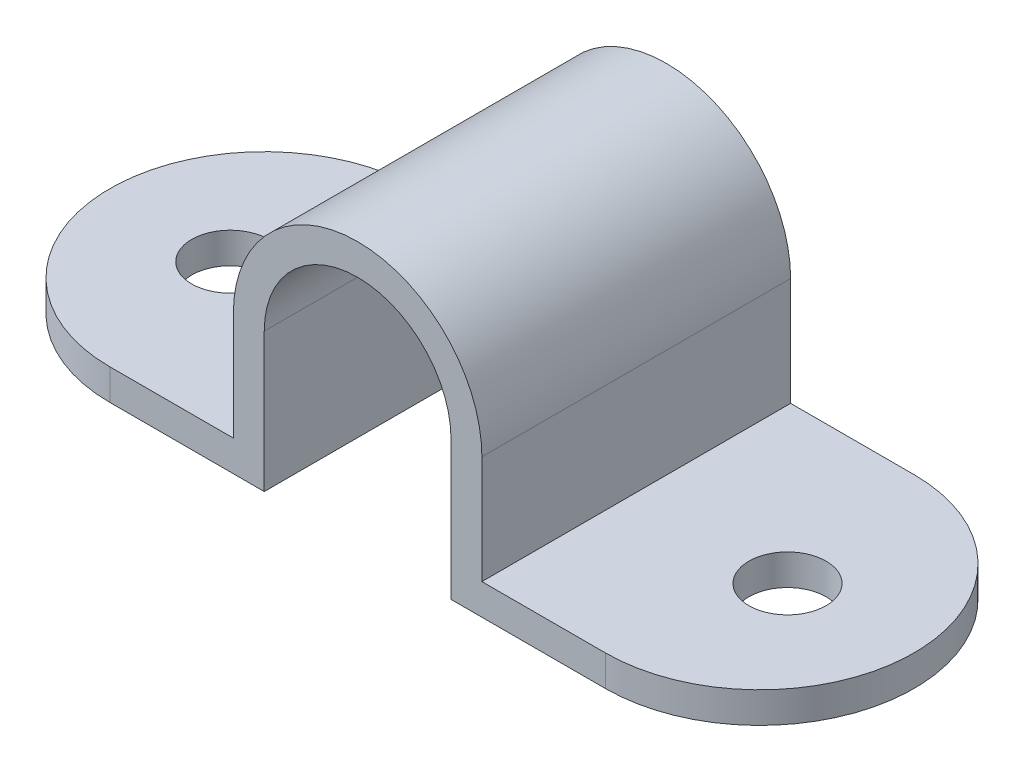
from build123d import *

# Parameters (mm, degrees)
Y_KSEKLIK_EKSTR_ZYON1_DEPTH = 20
Y_KSEKLIK_EKSTR_ZYON2_DEPTH = 2
IZIM3_R                     = 2.5
KES_EKSTR_ZYON1_DEPTH       = 10


with BuildPart() as part:
    # Çizim1 → Yükseklik-Ekstrüzyon1 (new body)
    with BuildSketch(Plane.XY):
        with BuildLine():
            Line((-6.05, 0), (-6.05, -9))
            Line((-6.05, -9), (-16.05, -9))
            Line((-16.05, -9), (-16.05, -7))
            Line((-16.05, -7), (-8.05, -7))
            Line((-8.05, -7), (-8.05, 0))
            ThreePointArc((-8.05, 0), (0, 8.05), (8.05, 0))
            Line((8.05, 0), (8.05, -7))
            Line((8.05, -7), (16.05, -7))
            Line((16.05, -7), (16.05, -9))
            Line((16.05, -9), (6.05, -9))
            Line((6.05, -9), (6.05, 0))
            ThreePointArc((6.05, 0), (0, 6.05), (-6.05, 0))
        make_face()
    extrude(amount=Y_KSEKLIK_EKSTR_ZYON1_DEPTH)

    # Çizim2 → Yükseklik-Ekstrüzyon2 (add)
    with BuildSketch(Plane(origin=(0, -7, 0), x_dir=(1, 0, 0), z_dir=(0, 1, 0))):
        with BuildLine():
            Line((16.05, 0), (16.05, -20))
            ThreePointArc((16.05, -20), (26.05, -10), (16.05, 0))
        make_face()
    y_kseklik_ekstr_zyon2 = extrude(amount=-Y_KSEKLIK_EKSTR_ZYON2_DEPTH)

    # Aynalama1: Yükseklik-Ekstrüzyon2 across plane
    add(y_kseklik_ekstr_zyon2.mirror(Plane(origin=(0, 0, 0), x_dir=(0, 0, 1), z_dir=(1, 0, 0))))

    # Çizim3 → Kes-Ekstrüzyon1 (cut)
    with BuildSketch(Plane(origin=(0, -7, 0), x_dir=(1, 0, 0), z_dir=(0, 1, 0))):
        with Locations(Location((18.05, -10.202041029, 0), (0, 0, 270))):
            Circle(IZIM3_R)
        with Locations(Location((-18.05, -10.202041029, 0), (0, 0, 270))):
            Circle(IZIM3_R)
    extrude(amount=-KES_EKSTR_ZYON1_DEPTH, mode=Mode.SUBTRACT)


solid = part.part
